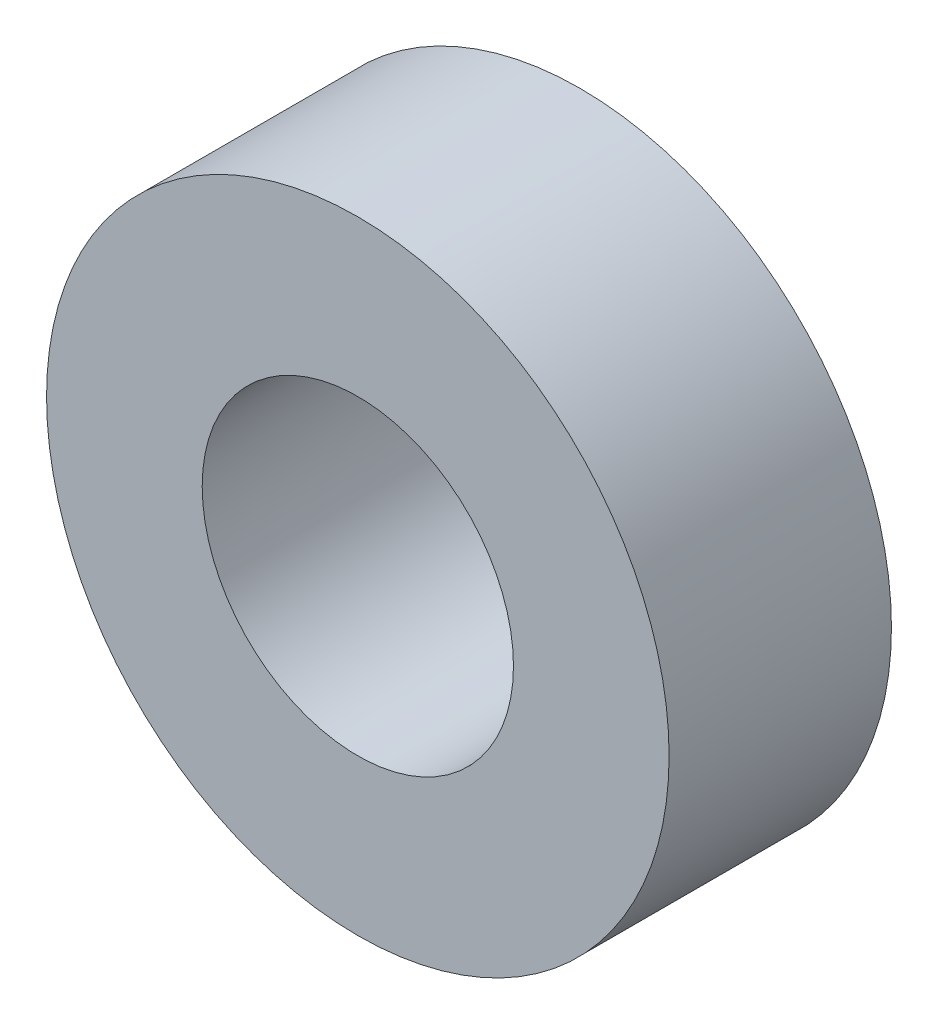
from build123d import *

# Parameters (mm, degrees)
F_0329_CYLINDER_SKETCH_R = 7
F_0329_CYLINDER_DEPTH    = 5
F_0330_CYLINDER_SKETCH_R = 3.5
F_0330_CYLINDER_DEPTH    = 6


with BuildPart() as part:
    # 0329_cylinder_Sketch → 0329_cylinder (new body)
    with BuildSketch(Plane.XY):
        Circle(F_0329_CYLINDER_SKETCH_R)
    extrude(amount=F_0329_CYLINDER_DEPTH)


with BuildPart() as part_1:
    # 0329_cylinder_Translate: moved
    add(part.part.moved(Location((0, 0, -2.5))))


with BuildPart() as body_2:
    # 0330_cylinder_Sketch → 0330_cylinder (new body)
    with BuildSketch(Plane.XY):
        Circle(F_0330_CYLINDER_SKETCH_R)
    extrude(amount=F_0330_CYLINDER_DEPTH)


with BuildPart() as body_2_1:
    # 0330_cylinder_Translate: moved
    add(body_2.part.moved(Location((0, 0, -3))))


with BuildPart() as part_2:
    add(part_1.part)

    # 0331_sub: cut body 2
    add(body_2_1.part, mode=Mode.SUBTRACT)


solid = part_2.part
